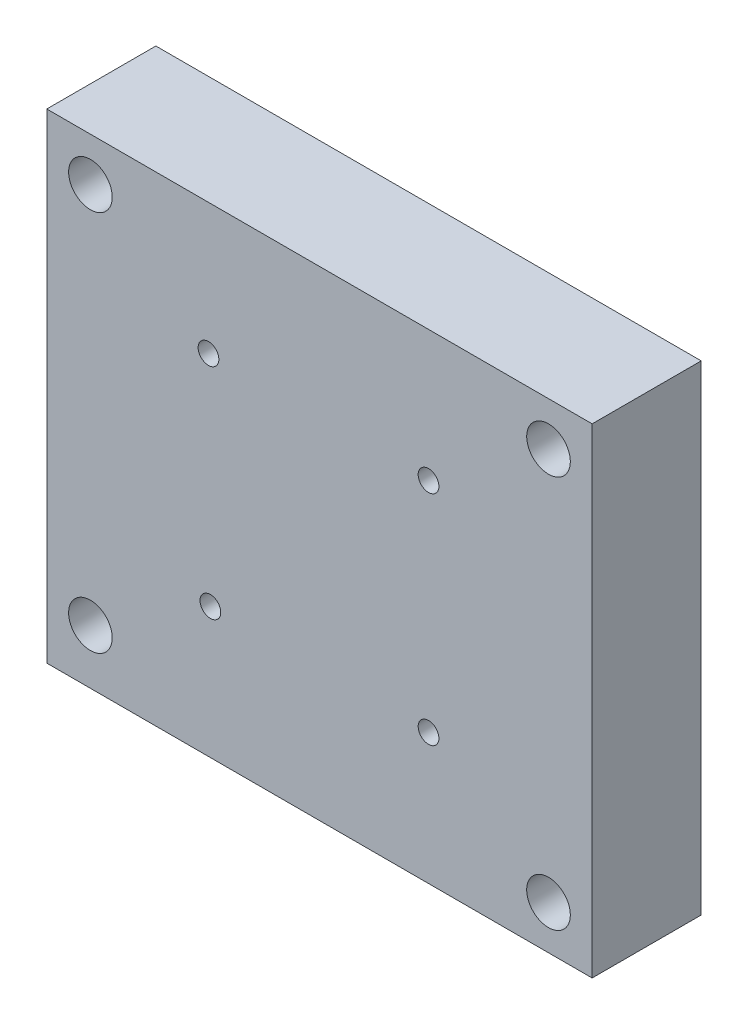
from build123d import *

# Parameters (mm, degrees)
SKETCH2_W                          = 5
SKETCH2_H                          = 22
BOSS_EXTRUDE1_DEPTH                = 25
TAP_DRILL_FOR_M2_5X0_45_TAP1_D     = 2.5
TAP_DRILL_FOR_M2_5X0_45_TAP1_DEPTH = 5
TAP_DRILL_FOR_M1_2X0_25_TAP1_D     = 0.95
TAP_DRILL_FOR_M2X0_4_TAP1_D        = 2


with BuildPart() as part:
    # Sketch2 → Boss-Extrude1 (new body)
    with BuildSketch(Plane(origin=(0, 0, 0), x_dir=(0, 0, -1), z_dir=(1, 0, 0))):
        with Locations((2.5, 5)):
            Rectangle(SKETCH2_W, SKETCH2_H)
    extrude(amount=BOSS_EXTRUDE1_DEPTH)

    # Tap Drill for M2.5x0.45 Tap1
    with Locations(Plane(origin=(0, -6, 0), x_dir=(-1, 0, 0), z_dir=(0, -1, 0))):
        with Locations((-19.5, 2.5), (-12.5, 2.5), (-5.5, 2.5)):
            Hole(TAP_DRILL_FOR_M2_5X0_45_TAP1_D / 2, depth=TAP_DRILL_FOR_M2_5X0_45_TAP1_DEPTH)

    # Tap Drill for M1.2x0.25 Tap1 (through all)
    with Locations(Plane(origin=(0, 0, -5), x_dir=(-1, 0, 0), z_dir=(0, 0, -1))):
        with Locations((-17.5, 10), (-7.413132908, 10), (-17.5, 0), (-7.5, 0)):
            Hole(TAP_DRILL_FOR_M1_2X0_25_TAP1_D / 2)

    # Tap Drill for M2x0.4 Tap1 (through all)
    with Locations(Plane.XY):
        with Locations((2, 14), (2, -3.5), (23, -4), (23, 14)):
            Hole(TAP_DRILL_FOR_M2X0_4_TAP1_D / 2)


solid = part.part
